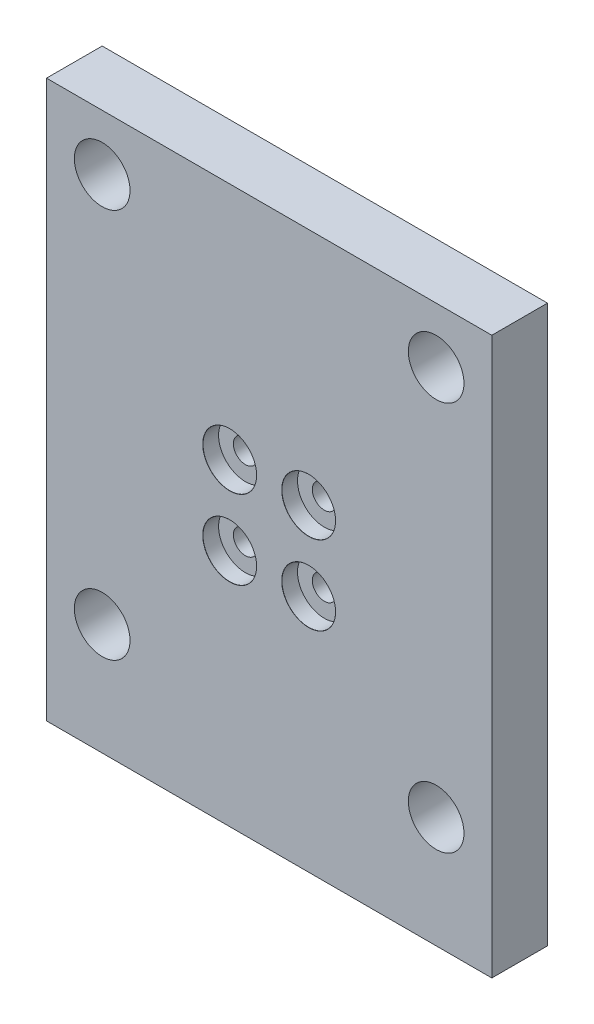
from build123d import *

# Parameters (mm, degrees)
SKETCH1_W                              = 101.6
SKETCH1_H                              = 127
BOSS_EXTRUDE1_DEPTH                    = 12.7
SKETCH4_R                              = 6.35
CUT_EXTRUDE9_DEPTH                     = 164.134453749
CBORE_FOR_M5_HEX_HEAD_BOLT1_AT_2_COUNT = 2
CBORE_FOR_M5_HEX_HEAD_BOLT1_AT_2_PITCH = 18.0086
CBORE_FOR_M5_HEX_HEAD_BOLT1_AT_3_COUNT = 2
CBORE_FOR_M5_HEX_HEAD_BOLT1_AT_3_PITCH = 25.461925967
CBORE_FOR_M5_HEX_HEAD_BOLT1_AT_4_COUNT = 2
CBORE_FOR_M5_HEX_HEAD_BOLT1_AT_4_PITCH = 18


with BuildPart() as part:
    # Sketch1 → Boss-Extrude1 (new body)
    with BuildSketch(Plane.XY):
        with Locations((50.8, 63.5)):
            Rectangle(SKETCH1_W, SKETCH1_H)
    extrude(amount=BOSS_EXTRUDE1_DEPTH)

    # Sketch4 → Cut-Extrude9 (cut, through all)
    with BuildSketch(Plane.XY.offset(12.7)):
        with Locations((12.7, 114.3)):
            Circle(SKETCH4_R)
        with Locations((12.7, 25.4)):
            Circle(SKETCH4_R)
        with Locations(Location((88.9, 25.4, 0), (0, 0, 180))):
            Circle(SKETCH4_R)
        with Locations(Location((88.9, 114.3, 0), (0, 0, 180))):
            Circle(SKETCH4_R)
    extrude(amount=-CUT_EXTRUDE9_DEPTH, mode=Mode.SUBTRACT)

    # Sketch8 → CBORE for M5 Hex Head Bolt1 (revolve, cut)
    with BuildSketch(Plane(origin=(41.7957, 72.5, 12.7), x_dir=(0, -1, 0), z_dir=(1, 0, 0))):
        Polygon((0, 0), (0, 12.7), (2.75, 12.7), (2.75, 3.58), (6.12, 3.58), (6.12, 0.025), (6.145, 0), align=None)
    cbore_for_m5_hex_head_bolt1 = revolve(axis=Axis((41.7957, 72.5, 19.05), (0, 0, -1)), mode=Mode.SUBTRACT)

    # CBORE for M5 Hex Head Bolt1 at 2: CBORE for M5 Hex Head Bolt1 ×2
    with Locations(*[(i * CBORE_FOR_M5_HEX_HEAD_BOLT1_AT_2_PITCH, 0, 0) for i in range(1, CBORE_FOR_M5_HEX_HEAD_BOLT1_AT_2_COUNT)]):
        add(cbore_for_m5_hex_head_bolt1, mode=Mode.SUBTRACT)

    # CBORE for M5 Hex Head Bolt1 at 3: CBORE for M5 Hex Head Bolt1 ×2
    with Locations(*[Vector(0.7072756406246394, -0.7069378814146302, 0) * (i * CBORE_FOR_M5_HEX_HEAD_BOLT1_AT_3_PITCH) for i in range(1, CBORE_FOR_M5_HEX_HEAD_BOLT1_AT_3_COUNT)]):
        add(cbore_for_m5_hex_head_bolt1, mode=Mode.SUBTRACT)

    # CBORE for M5 Hex Head Bolt1 at 4: CBORE for M5 Hex Head Bolt1 ×2
    with Locations(*[(0, -i * CBORE_FOR_M5_HEX_HEAD_BOLT1_AT_4_PITCH, 0) for i in range(1, CBORE_FOR_M5_HEX_HEAD_BOLT1_AT_4_COUNT)]):
        add(cbore_for_m5_hex_head_bolt1, mode=Mode.SUBTRACT)


solid = part.part
